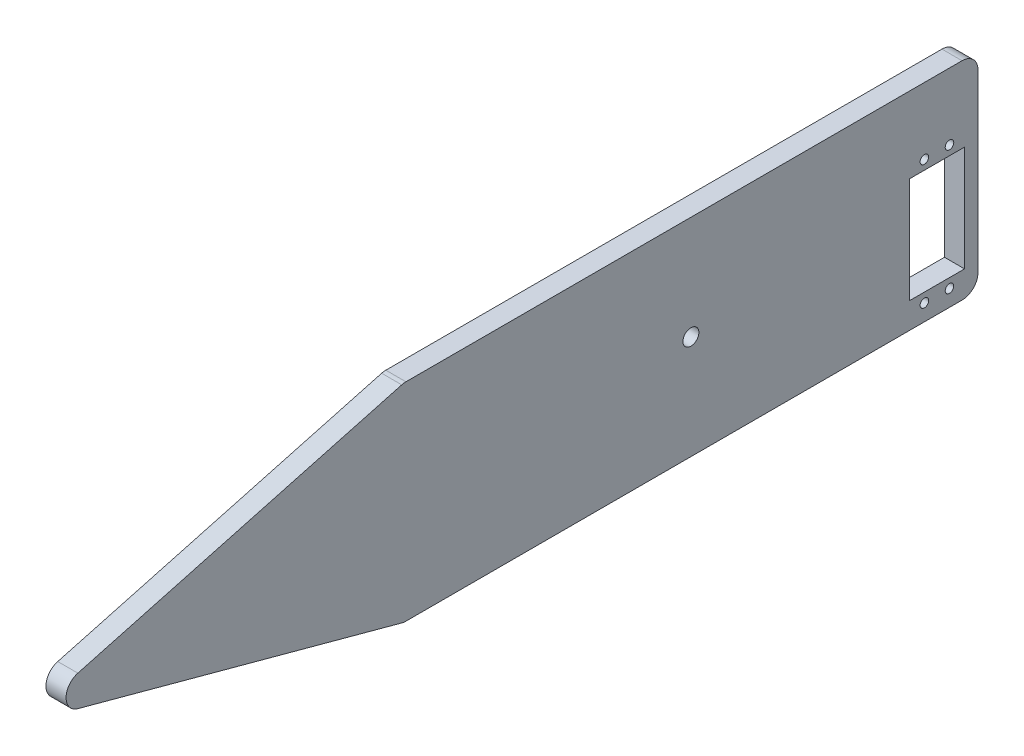
from build123d import *

# Parameters (mm, degrees)
SKETCH1_R           = 3.175
BOSS_EXTRUDE2_DEPTH = 4.0005
FILLET1_R           = 6.35
SKETCH6_R           = 1.7
CUT_EXTRUDE2_DEPTH  = 253.287066958
SKETCH5_W           = 42
SKETCH5_H           = 22
CUT_EXTRUDE1_DEPTH  = 253.287066958


with BuildPart() as part:
    # Sketch1 → Boss-Extrude2 (new, symmetric)
    with BuildSketch(Plane.YZ):
        Polygon((-41.275, 114.3), (-41.275, -114.3), (41.275, -114.3), (41.275, 114.3), (0, 266.7), align=None)
        with Locations(Location((0, 0, 0), (0, 0, 270))):
            Circle(SKETCH1_R, mode=Mode.SUBTRACT)
    extrude(amount=BOSS_EXTRUDE2_DEPTH, both=True)

    # Fillet1
    fillet1_edges = [part.edges().sort_by_distance(p)[0] for p in [
        (0, 0, 266.7),
        (0, 41.275, 114.3),
        (0, 41.275, -114.3),
        (0, -41.275, -114.3),
        (0, -41.275, 114.3),
    ]]
    fillet(fillet1_edges, radius=FILLET1_R)

    # Sketch6 → Cut-Extrude2 (cut, through all)
    with BuildSketch(Plane.YZ.offset(4.0005)):
        with Locations(Location((-34.75, -92.95, 0), (0, 0, 270))):
            Circle(SKETCH6_R)
        with Locations(Location((-34.75, -102.95, 0), (0, 0, 270))):
            Circle(SKETCH6_R)
        with Locations(Location((14.75, -92.95, 0), (0, 0, 270))):
            Circle(SKETCH6_R)
        with Locations(Location((14.75, -102.95, 0), (0, 0, 270))):
            Circle(SKETCH6_R)
    extrude(amount=-CUT_EXTRUDE2_DEPTH, mode=Mode.SUBTRACT)

    # Sketch5 → Cut-Extrude1 (cut, through all)
    with BuildSketch(Plane.YZ.offset(4.0005)):
        with Locations((-10, -97.95)):
            Rectangle(SKETCH5_W, SKETCH5_H)
    extrude(amount=-CUT_EXTRUDE1_DEPTH, mode=Mode.SUBTRACT)


solid = part.part
